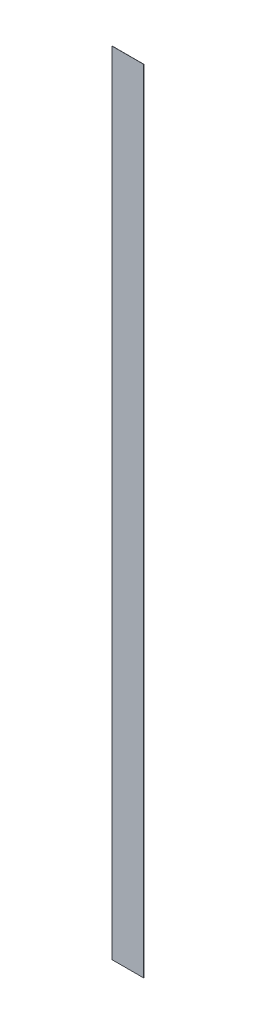
from build123d import *

# Parameters (mm, degrees)
SCHIZZO1_W                   = 3000
SCHIZZO1_H                   = 75000
ESTRUSIONE_ESTRUSIONE1_DEPTH = 15


with BuildPart() as part:
    # Schizzo1 → Estrusione-Estrusione1 (new body)
    with BuildSketch(Plane.XY):
        with Locations((-1500, 37500)):
            Rectangle(SCHIZZO1_W, SCHIZZO1_H)
    extrude(amount=ESTRUSIONE_ESTRUSIONE1_DEPTH)


solid = part.part
